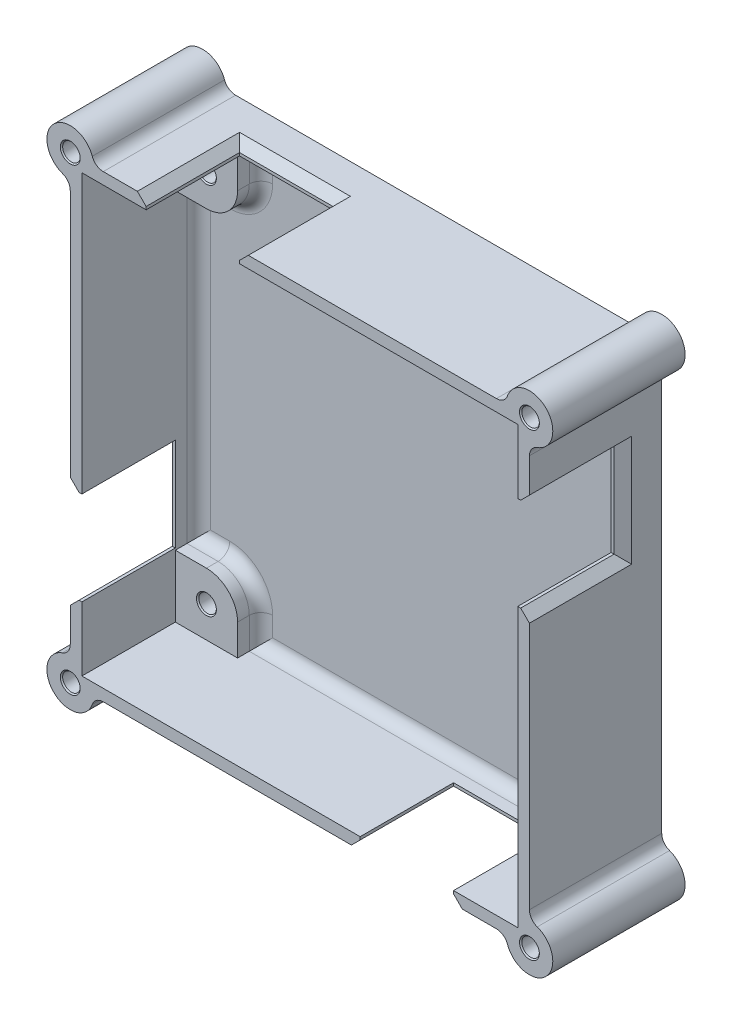
from build123d import *

# Parameters (mm, degrees)
SKETCH1_W                                  = 118
SKETCH1_H                                  = 118
BOSS_EXTRUDE1_DEPTH                        = 4
SKETCH2_W                                  = 118
SKETCH2_H                                  = 118
SKETCH2_W_2                                = 112
SKETCH2_H_2                                = 112
BOSS_EXTRUDE2_DEPTH                        = 30
SKETCH3_W                                  = 16
SKETCH3_H                                  = 16
SKETCH3_R                                  = 2.25
BOSS_EXTRUDE3_DEPTH                        = 6
MIRROR1_AT_THE_SECOND_PLANE_COPY_1_SKETC_W = 16
MIRROR1_AT_THE_SECOND_PLANE_COPY_1_SKETC_H = 16
MIRROR1_AT_THE_SECOND_PLANE_COPY_1_SKETC_R = 2.25
MIRROR1_AT_THE_SECOND_PLANE_COPY_1_DEPTH   = 6
CHAMFER1_SIZE                              = 0.3
FILLET1_R                                  = 8
SKETCH7_W                                  = 3
SKETCH7_H                                  = 24
SKETCH7_W_2                                = 24
SKETCH7_H_2                                = 3
CUT_EXTRUDE1_DEPTH                         = 24
CHAMFER3_SIZE                              = 2.25
BOSS_EXTRUDE4_DEPTH                        = 34
SKETCH9_R                                  = 2.25
CUT_EXTRUDE2_DEPTH                         = 6
MIRROR2_AT_THE_SECOND_PLANE_COPY_1_DEPTH   = 34
MIRROR2_AT_THE_SECOND_PLANE_COPY_2_SKETC_R = 2.25
MIRROR2_AT_THE_SECOND_PLANE_COPY_2_DEPTH   = 6
CHAMFER2_SIZE                              = 0.3
FILLET2_R                                  = 3
FILLET3_R                                  = 3


with BuildPart() as part:
    # Sketch1 → Boss-Extrude1 (new body)
    with BuildSketch(Plane.XY):
        Rectangle(SKETCH1_W, SKETCH1_H)
    extrude(amount=-BOSS_EXTRUDE1_DEPTH)

    # Sketch2 → Boss-Extrude2 (add)
    with BuildSketch(Plane.XY):
        Rectangle(SKETCH2_W, SKETCH2_H)
        Rectangle(SKETCH2_W_2, SKETCH2_H_2, mode=Mode.SUBTRACT)
    extrude(amount=BOSS_EXTRUDE2_DEPTH)

    # Sketch3 → Boss-Extrude3 (add)
    with BuildSketch(Plane.XY):
        with Locations((48, 48)):
            Rectangle(SKETCH3_W, SKETCH3_H)
        with Locations((48, 48)):
            Circle(SKETCH3_R, mode=Mode.SUBTRACT)
    boss_extrude3 = extrude(amount=BOSS_EXTRUDE3_DEPTH)

    # Mirror1: Boss-Extrude3 across plane
    add(boss_extrude3.mirror(Plane(origin=(0, 0, 0), x_dir=(0, 0, 1), z_dir=(1, 0, 0))))

    # Mirror1 at the second plane: Boss-Extrude3 across plane
    add(boss_extrude3.mirror(Plane.ZX))

    # Mirror1 at the second plane copy 1 sketc → Mirror1 at the second plane copy 1 (add)
    with BuildSketch(Plane(origin=(0, 0, 0), x_dir=(-1, 0, 0), z_dir=(0, 0, 1))):
        with Locations((48, 48)):
            Rectangle(MIRROR1_AT_THE_SECOND_PLANE_COPY_1_SKETC_W, MIRROR1_AT_THE_SECOND_PLANE_COPY_1_SKETC_H)
        with Locations((48, 48)):
            Circle(MIRROR1_AT_THE_SECOND_PLANE_COPY_1_SKETC_R, mode=Mode.SUBTRACT)
    extrude(amount=MIRROR1_AT_THE_SECOND_PLANE_COPY_1_DEPTH)

    # Chamfer1
    chamfer1_edges = [part.edges().sort_by_distance(p)[0] for p in [
        (45.75, 48, 6),
        (45.75, -48, 6),
        (-45.75, 48, 6),
        (-45.75, -48, 6),
    ]]
    chamfer(chamfer1_edges, length=CHAMFER1_SIZE)

    # Fillet1
    fillet1_edges = [part.edges().sort_by_distance(p)[0] for p in [
        (40, 40, 3),
        (40, -40, 3),
        (-40, 40, 3),
        (-40, -40, 3),
    ]]
    fillet(fillet1_edges, radius=FILLET1_R)

    # Sketch7 → Cut-Extrude1 (cut)
    with BuildSketch(Plane.XY.offset(30)):
        with Locations((57.5, 27.5)):
            Rectangle(SKETCH7_W, SKETCH7_H)
        with Locations((-27.5, 57.5)):
            Rectangle(SKETCH7_W_2, SKETCH7_H_2)
        with Locations((-57.5, -27.5)):
            Rectangle(SKETCH7_W, SKETCH7_H)
        with Locations((27.5, -57.5)):
            Rectangle(SKETCH7_W_2, SKETCH7_H_2)
    extrude(amount=-CUT_EXTRUDE1_DEPTH, mode=Mode.SUBTRACT)

    # Chamfer3
    chamfer3_edges = [part.edges().sort_by_distance(p)[0] for p in [
        (59, 27.5, 6),
        (59, 39.5, 18),
        (59, 15.5, 18),
        (-27.5, 59, 6),
        (-39.5, 59, 18),
        (-15.5, 59, 18),
        (-59, -27.5, 6),
        (-59, -39.5, 18),
        (-59, -15.5, 18),
        (15.5, -59, 18),
        (27.5, -59, 6),
        (39.5, -59, 18),
    ]]
    chamfer(chamfer3_edges, length=CHAMFER3_SIZE)

    # Sketch8 → Boss-Extrude4 (add)
    with BuildSketch(Plane.XY.offset(30)):
        with BuildLine():
            Line((53, 59), (59, 59))
            Line((59, 59), (59, 53))
            ThreePointArc((59, 53), (63.242640687, 63.242640687), (53, 59))
        make_face()
    boss_extrude4 = extrude(amount=-BOSS_EXTRUDE4_DEPTH)

    # Sketch9 → Cut-Extrude2 (cut)
    with BuildSketch(Plane.XY.offset(30)):
        with Locations((59, 59)):
            Circle(SKETCH9_R)
    cut_extrude2 = extrude(amount=-CUT_EXTRUDE2_DEPTH, mode=Mode.SUBTRACT)

    # Mirror2: Boss-Extrude4, Cut-Extrude2 across plane
    add(boss_extrude4.mirror(Plane(origin=(0, 0, 0), x_dir=(0, 0, 1), z_dir=(1, 0, 0))))
    add(cut_extrude2.mirror(Plane(origin=(0, 0, 0), x_dir=(0, 0, 1), z_dir=(1, 0, 0))), mode=Mode.SUBTRACT)

    # Mirror2 at the second plane: Boss-Extrude4, Cut-Extrude2 across plane
    add(boss_extrude4.mirror(Plane.ZX))
    add(cut_extrude2.mirror(Plane.ZX), mode=Mode.SUBTRACT)

    # Mirror2 at the second plane copy 1 sketc → Mirror2 at the second plane copy 1 (add)
    with BuildSketch(Plane(origin=(0, 0, 30), x_dir=(-1, 0, 0), z_dir=(0, 0, 1))):
        with BuildLine():
            Line((53, 59), (59, 59))
            Line((59, 59), (59, 53))
            ThreePointArc((59, 53), (63.242640687, 63.242640687), (53, 59))
        make_face()
    extrude(amount=-MIRROR2_AT_THE_SECOND_PLANE_COPY_1_DEPTH)

    # Mirror2 at the second plane copy 2 sketc → Mirror2 at the second plane copy 2 (cut)
    with BuildSketch(Plane(origin=(0, 0, 30), x_dir=(-1, 0, 0), z_dir=(0, 0, 1))):
        with Locations((59, 59)):
            Circle(MIRROR2_AT_THE_SECOND_PLANE_COPY_2_SKETC_R)
    extrude(amount=-MIRROR2_AT_THE_SECOND_PLANE_COPY_2_DEPTH, mode=Mode.SUBTRACT)

    # Chamfer2
    chamfer2_edges = [part.edges().sort_by_distance(p)[0] for p in [
        (56.75, 59, 30),
        (56.75, -59, 30),
        (-56.75, 59, 30),
        (-56.75, -59, 30),
    ]]
    chamfer(chamfer2_edges, length=CHAMFER2_SIZE)

    # Fillet2
    fillet2_edges = [part.edges().sort_by_distance(p)[0] for p in [
        (-42.343145751, 42.343145751, 0),
        (-42.343145751, -42.343145751, 0),
        (42.343145751, -42.343145751, 0),
        (42.343145751, 42.343145751, 0),
        (0, 56, 0),
        (40, 52, 0),
        (52, 40, 0),
        (56, 0, 0),
        (52, -40, 0),
        (40, -52, 0),
        (-56, 0, 0),
        (-52, 40, 0),
        (-40, 52, 0),
        (0, -56, 0),
        (-40, -52, 0),
        (-52, -40, 0),
    ]]
    fillet(fillet2_edges, radius=FILLET2_R)

    # Fillet3
    fillet3_edges = [part.edges().sort_by_distance(p)[0] for p in [
        (53, 59, 13),
        (59, 53, 13),
        (59, -53, 13),
        (53, -59, 13),
        (-59, 53, 13),
        (-53, 59, 13),
        (-53, -59, 13),
        (-59, -53, 13),
    ]]
    fillet(fillet3_edges, radius=FILLET3_R)


solid = part.part
